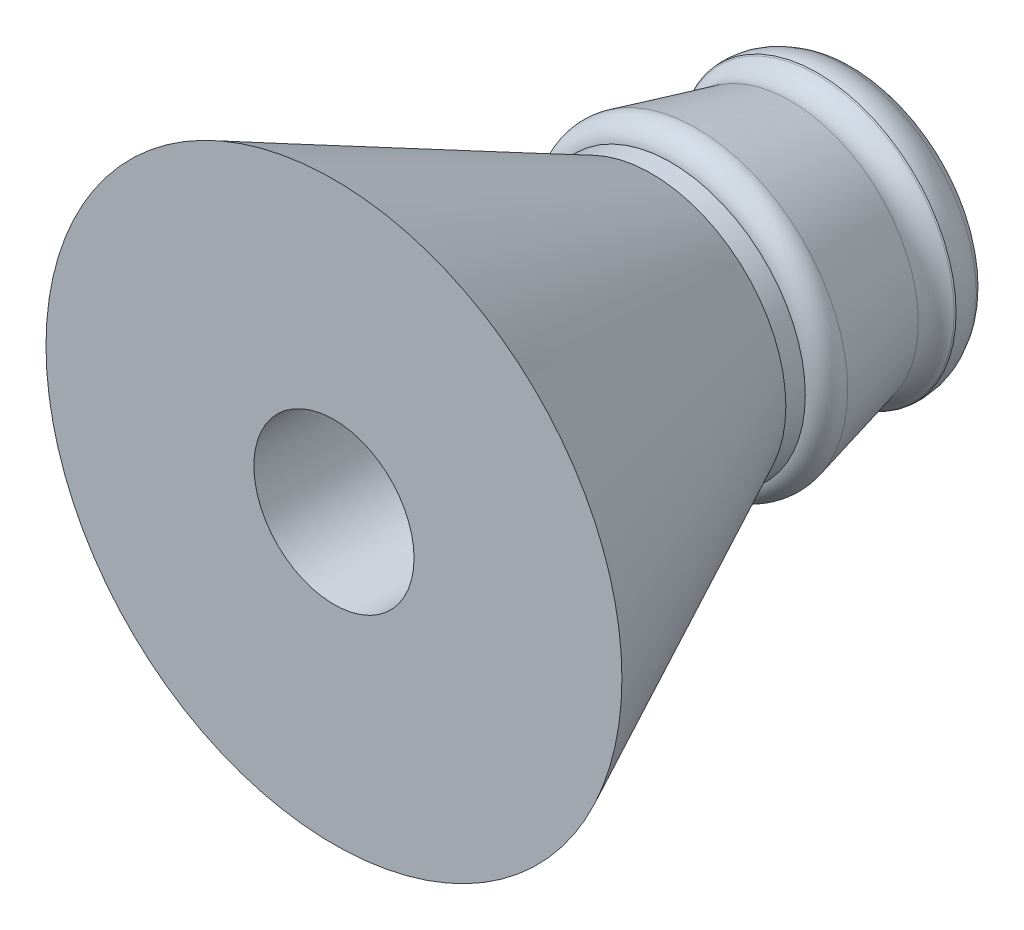
from build123d import *


with BuildPart() as part:
    # Sketch1 → Revolve1 (revolve)
    with BuildSketch(Plane(origin=(0, 0, 0), x_dir=(1, 0, 0), z_dir=(0, 1, 0)), mode=Mode.PRIVATE) as revolve1_sk:
        with BuildLine():
            Line((-7.75, 0), (-7.75, 3.59874773))
            ThreePointArc((-7.75, 3.59874773), (-9.737150145, 8.834353772), (-9.25, 14.413154814))
            Line((-9.25, 14.413154814), (-9.25, 19.477254176))
            ThreePointArc((-9.25, 19.477254176), (-9.396446609, 19.830807566), (-9.75, 19.977254176))
            Line((-9.75, 19.977254176), (-10.624554433, 19.977254176))
            ThreePointArc((-10.624554433, 19.977254176), (-11.860926928, 19.63428676), (-12.743936524, 18.703406721))
            ThreePointArc((-12.743936524, 18.703406721), (-13.301894318, 17.444688456), (-13.4, 16.071348059))
            ThreePointArc((-13.4, 16.071348059), (-13.353676429, 16.020899185), (-13.300893142, 15.977254176))
            ThreePointArc((-13.300893142, 15.977254176), (-12.447206352, 14.854853584), (-12.371266932, 13.446735184))
            Line((-12.371266932, 13.446735184), (-14.64061089, 4.343335661))
            ThreePointArc((-14.64061089, 4.343335661), (-14.364146668, 2.750238564), (-13, 1.882197841))
            Line((-13, 1.882197841), (-13, 0))
            Line((-13, 0), (-27.863515915, -30.725250222))
            Line((-27.863515915, -30.725250222), (-7.75, -30.725250222))
            Line((-7.75, -30.725250222), (-7.75, 0))
        make_face()
    revolve(revolve1_sk.sketch.rotate(Axis((0, 0, 0), (0, 0, -1)), 180), axis=Axis((0, 0, 0), (0, 0, -1)))


solid = part.part
